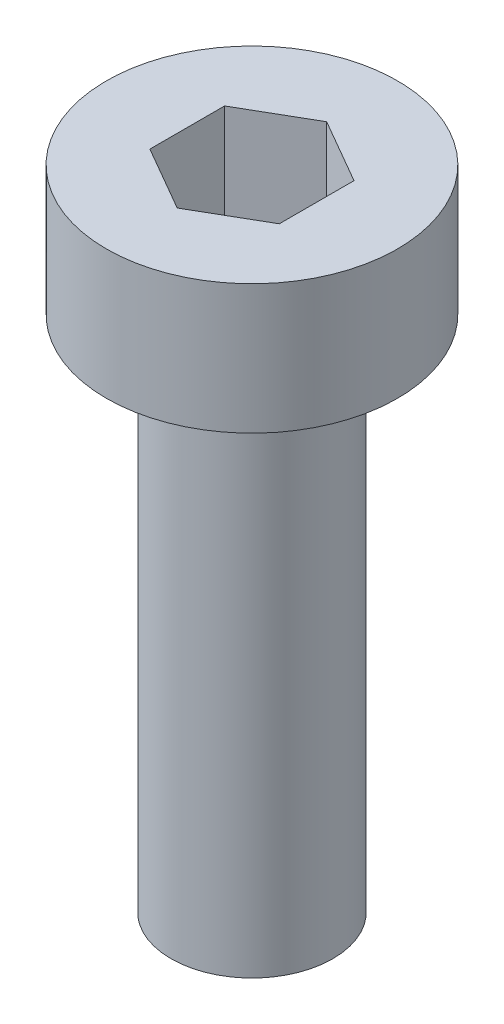
from build123d import *

# Parameters (mm, degrees)
SKETCH_1_R      = 2.25
EXTRUDE_1_DEPTH = 2
SKETCH_2_R      = 1.25
EXTRUDE_2_DEPTH = 8


with BuildPart() as part:
    # 草图1 → 凸台-拉伸1 (new body)
    with BuildSketch(Plane(origin=(0, 0, 0), x_dir=(1, 0, 0), z_dir=(0, 1, 0))):
        with Locations(Location((0, 0, 0), (0, 0, 270))):
            Circle(SKETCH_1_R)
        Polygon((0, 1.154700538), (-1, 0.577350269), (-1, -0.577350269), (0, -1.154700538), (1, -0.577350269), (1, 0.577350269), align=None, mode=Mode.SUBTRACT)
    extrude(amount=EXTRUDE_1_DEPTH)

    # 草图2 → 凸台-拉伸2 (add)
    with BuildSketch(Plane.XZ):
        with Locations(Location((0, 0, 0), (0, 0, 90))):
            Circle(SKETCH_2_R)
    extrude(amount=EXTRUDE_2_DEPTH)


solid = part.part
